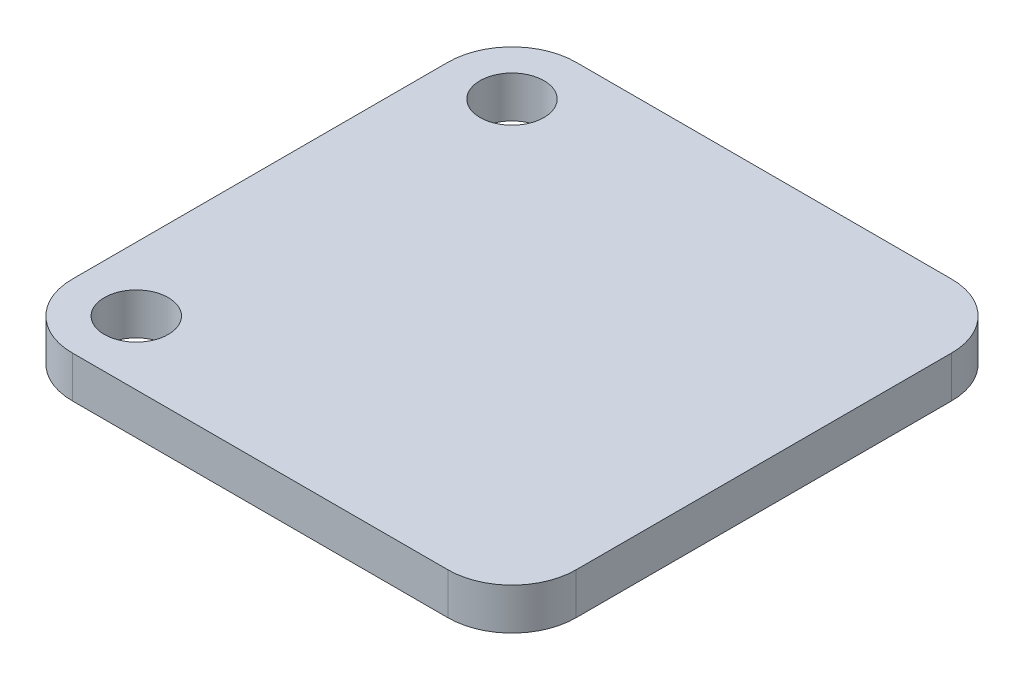
from build123d import *

# Parameters (mm, degrees)
SKETCH2_W           = 20
SKETCH2_H           = 20
BOSS_EXTRUDE1_DEPTH = 1.65
FILLET1_R           = 2.54
SKETCH3_R           = 1.27
CUT_EXTRUDE1_DEPTH  = 15.238065178


with BuildPart() as part:
    # Sketch2 → Boss-Extrude1 (new body)
    with BuildSketch(Plane(origin=(0, 0, 0), x_dir=(1, 0, 0), z_dir=(0, 1, 0))):
        Rectangle(SKETCH2_W, SKETCH2_H)
    extrude(amount=BOSS_EXTRUDE1_DEPTH)

    # Fillet1
    fillet1_edges = [part.edges().sort_by_distance(p)[0] for p in [
        (-10, 0.825, -10),
        (10, 0.825, -10),
        (10, 0.825, 10),
        (-10, 0.825, 10),
    ]]
    fillet(fillet1_edges, radius=FILLET1_R)

    # Sketch3 → Cut-Extrude1 (cut, through all)
    with BuildSketch(Plane(origin=(0, 1.65, 0), x_dir=(1, 0, 0), z_dir=(0, 1, 0))):
        with Locations(Location((-7.46, 7.46, 0), (0, 0, 270))):
            Circle(SKETCH3_R)
        with Locations(Location((-7.46, -7.46, 0), (0, 0, 270))):
            Circle(SKETCH3_R)
    extrude(amount=-CUT_EXTRUDE1_DEPTH, mode=Mode.SUBTRACT)


solid = part.part
